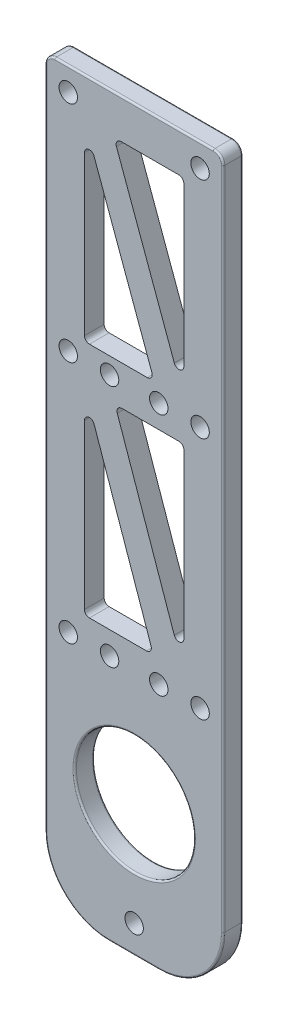
from build123d import *

# Parameters (mm, degrees)
SKETCH1_R           = 12.1
SKETCH1_W           = 20.2
SKETCH1_H           = 40.2
BASE_PLATE_DEPTH    = 4
FILLET1_R           = 1
FILLET2_R           = 2
SKETCH2_R           = 1.875
CUT_EXTRUDE1_DEPTH  = 78.256779638
SKETCH3_W           = 4
SKETCH3_H           = 40.2
BOSS_EXTRUDE1_DEPTH = 28.2
CUT_EXTRUDE2_DEPTH  = 78.256779638
FILLET3_R           = 1
FILLET5_R           = 0.35


with BuildPart() as part:
    # Sketch1 → Base Plate (new body)
    with BuildSketch(Plane.XY):
        with BuildLine():
            Line((-18.1, -62), (-18.1, 75))
            Line((-18.1, 75), (18.1, 75))
            Line((18.1, 75), (18.1, -62))
            ThreePointArc((18.1, -62), (14.292388155, -71.192388155), (5.1, -75))
            Line((5.1, -75), (-5.1, -75))
            ThreePointArc((-5.1, -75), (-14.292388155, -71.192388155), (-18.1, -62))
        make_face()
        with Locations((0, -48.3)):
            Circle(SKETCH1_R, mode=Mode.SUBTRACT)
        Polygon((-10.1, 28.1), (4.1, 28.1), (-10.1, 67), align=None, mode=Mode.SUBTRACT)
        Rectangle(SKETCH1_W, SKETCH1_H, mode=Mode.SUBTRACT)
        Polygon((10.1, 67), (-4.1, 67), (10.1, 28.1), align=None, mode=Mode.SUBTRACT)
    extrude(amount=BASE_PLATE_DEPTH)

    # Fillet1
    fillet1_edges = [part.edges().sort_by_distance(p)[0] for p in [
        (10.1, 28.1, 2),
        (10.1, 67, 2),
        (-4.1, 67, 2),
        (-10.1, 67, 2),
        (-10.1, 28.1, 2),
        (4.1, 28.1, 2),
    ]]
    fillet(fillet1_edges, radius=FILLET1_R)

    # Fillet2
    fillet2_edges = [part.edges().sort_by_distance(p)[0] for p in [
        (-18.1, 75, 2),
        (18.1, 75, 2),
    ]]
    fillet(fillet2_edges, radius=FILLET2_R)

    # Sketch2 → Cut-Extrude1 (cut, through all)
    with BuildSketch(Plane.XY.offset(4)):
        with Locations((5, 24.75)):
            Circle(SKETCH2_R)
        with Locations((-5, 24.75)):
            Circle(SKETCH2_R)
        with Locations(Location((-5, -24.75, 0), (0, 0, 180))):
            Circle(SKETCH2_R)
        with Locations(Location((5, -24.75, 0), (0, 0, 180))):
            Circle(SKETCH2_R)
        with Locations((13.4, 24.75)):
            Circle(SKETCH2_R)
        with Locations(Location((-13.4, 24.75, 0), (0, 0, 180))):
            Circle(SKETCH2_R)
        with Locations(Location((13.4, -24.75, 0), (0, 0, 180))):
            Circle(SKETCH2_R)
        with Locations((-13.4, -24.75)):
            Circle(SKETCH2_R)
        with Locations((13.4, 70.3)):
            Circle(SKETCH2_R)
        with Locations(Location((-13.4, 70.3, 0), (0, 0, 180))):
            Circle(SKETCH2_R)
        with Locations((0, -69.3)):
            Circle(SKETCH2_R)
    extrude(amount=-CUT_EXTRUDE1_DEPTH, mode=Mode.SUBTRACT)

    # Sketch3 → Boss-Extrude1 (add, through all)
    with BuildSketch(Plane.ZY.offset(-10.1)):
        with Locations((2, 0)):
            Rectangle(SKETCH3_W, SKETCH3_H)
    extrude(amount=BOSS_EXTRUDE1_DEPTH)

    # Sketch4 → Cut-Extrude2 (cut, through all)
    with BuildSketch(Plane.XY.offset(4)):
        Polygon((-10.1, 20.1), (-10.1, -20.1), (3.9, -20.1), align=None)
        Polygon((-3.9, 20.1), (10.1, 20.1), (10.1, -20.1), align=None)
    extrude(amount=-CUT_EXTRUDE2_DEPTH, mode=Mode.SUBTRACT)

    # Fillet3
    fillet3_edges = [part.edges().sort_by_distance(p)[0] for p in [
        (10.1, -20.1, 2),
        (-3.9, 20.1, 2),
        (10.1, 20.1, 2),
        (-10.1, 20.1, 2),
        (3.9, -20.1, 2),
        (-10.1, -20.1, 2),
    ]]
    fillet(fillet3_edges, radius=FILLET3_R)

    # Fillet5
    fillet5_edges = [part.edges().sort_by_distance(p)[0] for p in [
        (17.514213562, 74.414213562, 4),
        (-17.514213562, 74.414213562, 4),
        (-14.292388155, -71.192388155, 4),
        (0, -75, 4),
        (14.292388155, -71.192388155, 4),
        (-12.1, -48.3, 0),
        (-12.1, -48.3, 4),
        (18.1, 5.5, 4),
        (14.292388155, -71.192388155, 0),
        (0, -75, 0),
        (-14.292388155, -71.192388155, 0),
        (18.1, 5.5, 0),
        (-18.1, 5.5, 0),
        (-18.1, 5.5, 4),
        (0, 75, 0),
        (17.514213562, 74.414213562, 0),
        (-17.514213562, 74.414213562, 0),
        (0, 75, 4),
    ]]
    fillet(fillet5_edges, radius=FILLET5_R)


solid = part.part
